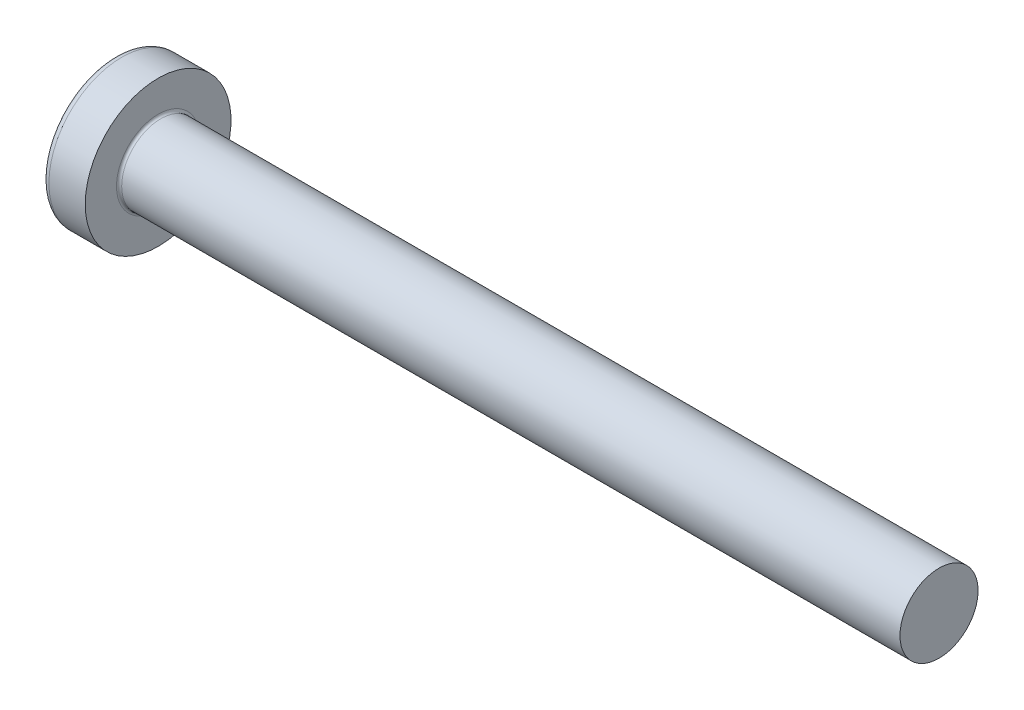
from build123d import *

# Parameters (mm, degrees)
FILLET1_R    = 0.1
RECPAT_COUNT = 2
RECPAT_ANGLE = 90


with BuildPart() as part:
    # BodySke → Base-Revolve (revolve)
    with BuildSketch(Plane.XY, mode=Mode.PRIVATE) as base_revolve_sk:
        with BuildLine():
            Line((2.4, 1.5), (2.4, 2.8))
            Line((2.4, 2.8), (1.003501533, 2.8))
            ThreePointArc((1.003501533, 2.8), (0.873295971, 2.76653015), (0.775371599, 2.674418605))
            ThreePointArc((0.775371599, 2.674418605), (0.197753546, 1.392274756), (0, 0))
            Line((0, 0), (32.4, 0))
            Line((32.4, 0), (32.4, 1.5))
            Line((32.4, 1.5), (2.4, 1.5))
        make_face()
    revolve(base_revolve_sk.sketch.rotate(Axis((1.003501533, 0, 0), (1, 0, 0)), 90), axis=Axis((1.003501533, 0, 0), (1, 0, 0)))

    # Fillet1
    fillet1_edges = [part.edges().sort_by_distance(p)[0] for p in [
        (2.4, 0, -1.5),
    ]]
    fillet(fillet1_edges, radius=FILLET1_R)

    # Sketch3 → Recess section 0
    with BuildSketch(Plane(origin=(0, 0, 0), x_dir=(0, 0, -1), z_dir=(1, 0, 0))):
        with BuildLine():
            Line((0.37, -1.4), (-0.37, -1.4))
            Line((-0.37, -1.4), (-0.37, 1.4))
            Line((-0.37, 1.4), (0.37, 1.4))
            Line((0.37, 1.4), (0.37, -1.4))
        make_face()
    # Sketch4 → Recess section 1
    with BuildSketch(Plane(origin=(1.75, 0, 0), x_dir=(0, 0, -1), z_dir=(1, 0, 0))):
        with BuildLine():
            Line((0.37, -0.527482332), (-0.37, -0.527482332))
            Line((-0.37, -0.527482332), (-0.37, 0.527482332))
            Line((-0.37, 0.527482332), (0.37, 0.527482332))
            Line((0.37, 0.527482332), (0.37, -0.527482332))
        make_face()
    recess = loft(mode=Mode.SUBTRACT)

    # RecPat: Recess ×2 about axis
    recpat_axis = Axis((0, 0, 0), (1, 0, 0))
    for i in range(1, RECPAT_COUNT):
        add(recess.rotate(recpat_axis, i * RECPAT_ANGLE / (RECPAT_COUNT - 1)), mode=Mode.SUBTRACT)

    # RecCorSke → RecessCore (revolve, cut)
    with BuildSketch(Plane.XY, mode=Mode.PRIVATE) as recesscore_sk:
        Polygon((0, 0), (0, 0.678371921), (1.75, 0.556), (1.930655351, 0), align=None)
    revolve(recesscore_sk.sketch.rotate(Axis((-3.175, 0, 0), (1, 0, 0)), 15.814025638), axis=Axis((-3.175, 0, 0), (1, 0, 0)), mode=Mode.SUBTRACT)


solid = part.part
